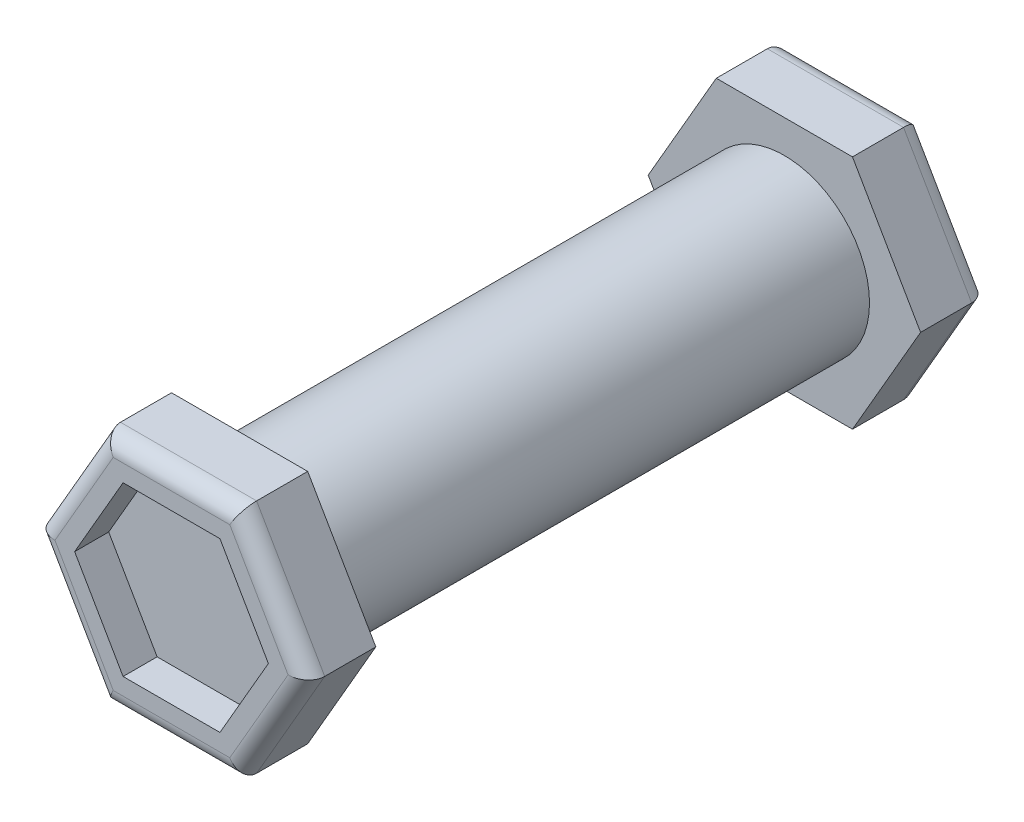
from build123d import *

# Parameters (mm, degrees)
BOSS_EXTRUDE1_DEPTH      = 2
BOSS_EXTRUDE1_DEPTH_BACK = 2
SKETCH1_R                = 0.625
BOSS_EXTRUDE2_DEPTH      = 0.5
FILLET1_R                = 0.125
CUT_EXTRUDE2_DEPTH       = 0.25
FILLET1_OF_MIRROR1_R     = 0.125
SCALE1_SCALE             = 6


with BuildPart() as part:
    # Sketch1 → Boss-Extrude1 (new, two sides: drawn at the far end of the back side and taken through both)
    with BuildSketch(Plane.XY.offset(-BOSS_EXTRUDE1_DEPTH_BACK)):
        Circle(SKETCH1_R)
    extrude(amount=BOSS_EXTRUDE1_DEPTH + BOSS_EXTRUDE1_DEPTH_BACK)

    # Sketch2 → Boss-Extrude2 (add)
    with BuildSketch(Plane.XY.offset(2)):
        Polygon((1, 0), (0.5, 0.866025404), (-0.5, 0.866025404), (-1, 0), (-0.5, -0.866025404), (0.5, -0.866025404), align=None)
    boss_extrude2 = extrude(amount=BOSS_EXTRUDE2_DEPTH)

    # Fillet1
    fillet1_edges = [part.edges().sort_by_distance(p)[0] for p in [
        (0, -0.866025404, 2.5),
        (-0.75, -0.433012702, 2.5),
        (-0.75, 0.433012702, 2.5),
        (0, 0.866025404, 2.5),
        (0.75, 0.433012702, 2.5),
        (0.75, -0.433012702, 2.5),
    ]]
    fillet(fillet1_edges, radius=FILLET1_R)

    # Sketch6 → Cut-Extrude2 (cut)
    with BuildSketch(Plane.XY.offset(2.5)):
        Polygon((-0.711324865, 0), (-0.355662433, -0.616025404), (0.355662433, -0.616025404), (0.711324865, 0), (0.355662433, 0.616025404), (-0.355662433, 0.616025404), align=None)
    cut_extrude2 = extrude(amount=-CUT_EXTRUDE2_DEPTH, mode=Mode.SUBTRACT)

    # Mirror1: Boss-Extrude2, Cut-Extrude2 across plane
    add(boss_extrude2.mirror(Plane.XY))
    add(cut_extrude2.mirror(Plane.XY), mode=Mode.SUBTRACT)

    # Fillet1 of Mirror1
    fillet1_of_mirror1_edges = [part.edges().sort_by_distance(p)[0] for p in [
        (0, -0.866025404, -2.5),
        (-0.75, -0.433012702, -2.5),
        (-0.75, 0.433012702, -2.5),
        (0, 0.866025404, -2.5),
        (0.75, 0.433012702, -2.5),
        (0.75, -0.433012702, -2.5),
    ]]
    fillet(fillet1_of_mirror1_edges, radius=FILLET1_OF_MIRROR1_R)


with BuildPart() as part_1:
    # Scale1: scaled about (0, 0, 0)
    add(part.part.scale(SCALE1_SCALE))


solid = part_1.part
